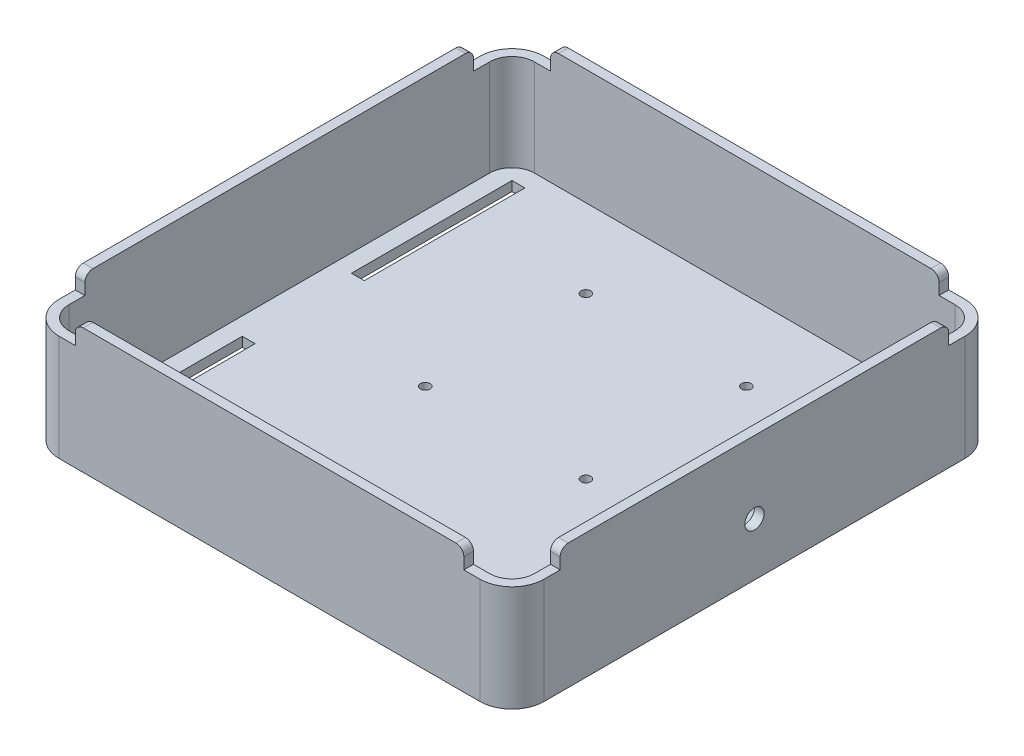
from build123d import *

# Parameters (mm, degrees)
SKETCH1_W           = 151
SKETCH1_H           = 151
BOSS_EXTRUDE1_DEPTH = 16.5
SKETCH2_W           = 145
SKETCH2_H           = 145
CUT_EXTRUDE1_DEPTH  = 30
SKETCH3_W           = 4
SKETCH3_H           = 50
CUT_EXTRUDE2_DEPTH  = 111.907619215
SKETCH6_W           = 121
SKETCH6_H           = 3
BOSS_EXTRUDE2_DEPTH = 6
SKETCH7_W           = 3
SKETCH7_H           = 121
BOSS_EXTRUDE3_DEPTH = 6
CUT_EXTRUDE3_REACH  = 172.316
SKETCH8_R           = 3
FILLET1_R           = 10
FILLET2_R           = 7
FILLET3_R           = 2.5
SKETCH12_R          = 1.5
CUT_EXTRUDE4_DEPTH  = 114.672775984


with BuildPart() as part:
    # Sketch1 → Boss-Extrude1 (new, symmetric)
    with BuildSketch(Plane(origin=(0, 0, 0), x_dir=(1, 0, 0), z_dir=(0, 1, 0))):
        Rectangle(SKETCH1_W, SKETCH1_H)
    extrude(amount=BOSS_EXTRUDE1_DEPTH, both=True)

    # Sketch2 → Cut-Extrude1 (cut)
    with BuildSketch(Plane(origin=(0, 16.5, 0), x_dir=(1, 0, 0), z_dir=(0, 1, 0))):
        Rectangle(SKETCH2_W, SKETCH2_H)
    extrude(amount=-CUT_EXTRUDE1_DEPTH, mode=Mode.SUBTRACT)

    # Sketch3 → Cut-Extrude2 (cut, through all)
    with BuildSketch(Plane(origin=(0, -13.5, 0), x_dir=(1, 0, 0), z_dir=(0, 1, 0))):
        with Locations((-65, -42)):
            Rectangle(SKETCH3_W, SKETCH3_H)
        with Locations((-65, 42)):
            Rectangle(SKETCH3_W, SKETCH3_H)
    cut_extrude2 = extrude(amount=-CUT_EXTRUDE2_DEPTH, mode=Mode.SUBTRACT)

    # Mirror1: Cut-Extrude2 across plane
    add(cut_extrude2.mirror(Plane(origin=(0, 0, 0), x_dir=(0, 0, 1), z_dir=(1, 0, 0))), mode=Mode.SUBTRACT)

    # Sketch6 → Boss-Extrude2 (add)
    with BuildSketch(Plane(origin=(0, 16.5, 0), x_dir=(1, 0, 0), z_dir=(0, 1, 0))):
        with Locations((0, -74)):
            Rectangle(SKETCH6_W, SKETCH6_H)
    boss_extrude2 = extrude(amount=BOSS_EXTRUDE2_DEPTH)

    # Mirror2: Boss-Extrude2 across plane
    add(boss_extrude2.mirror(Plane.XY))

    # Sketch7 → Boss-Extrude3 (add)
    with BuildSketch(Plane(origin=(0, 16.5, 0), x_dir=(1, 0, 0), z_dir=(0, 1, 0))):
        with Locations((-74, 0)):
            Rectangle(SKETCH7_W, SKETCH7_H)
    boss_extrude3 = extrude(amount=BOSS_EXTRUDE3_DEPTH)

    # Mirror4: Boss-Extrude3 across plane
    add(boss_extrude3.mirror(Plane(origin=(0, 0, 0), x_dir=(0, 0, 1), z_dir=(1, 0, 0))))

    # Sketch8 → Cut-Extrude3 (cut, up to next)
    with BuildSketch(Plane(origin=(75.5, 0, 0), x_dir=(0, 0, -1), z_dir=(1, 0, 0)), mode=Mode.PRIVATE) as cut_extrude3_sk1:
        Circle(SKETCH8_R)
    cut_extrude3_tool1 = extrude(cut_extrude3_sk1.sketch, amount=-CUT_EXTRUDE3_REACH, mode=Mode.PRIVATE) & part.part
    add(cut_extrude3_tool1.solids().sort_by_distance((75.5, 0, 0))[0], mode=Mode.SUBTRACT)

    # Fillet1
    fillet1_edges = [part.edges().sort_by_distance(p)[0] for p in [
        (75.5, 0, 75.5),
        (-75.5, 0, 75.5),
        (-75.5, 0, -75.5),
        (75.5, 0, -75.5),
    ]]
    fillet(fillet1_edges, radius=FILLET1_R)

    # Fillet2
    fillet2_edges = [part.edges().sort_by_distance(p)[0] for p in [
        (72.5, 1.5, -72.5),
        (72.5, 1.5, 72.5),
        (-72.5, 1.5, 72.5),
        (-72.5, 1.5, -72.5),
    ]]
    fillet(fillet2_edges, radius=FILLET2_R)

    # Fillet3
    fillet3_edges = [part.edges().sort_by_distance(p)[0] for p in [
        (-60.5, 22.5, -74),
        (60.5, 22.5, -74),
        (-74, 22.5, -60.5),
        (-74, 22.5, 60.5),
        (74, 22.5, 60.5),
        (74, 22.5, -60.5),
        (-60.5, 22.5, 74),
        (60.5, 22.5, 74),
    ]]
    fillet(fillet3_edges, radius=FILLET3_R)

    # Sketch12 → Cut-Extrude4 (cut, through all)
    with BuildSketch(Plane.XZ.offset(16.5)):
        with Locations(Location((-25, 52, 0), (0, 0, 270))):
            Circle(SKETCH12_R)
        with Locations(Location((-25, 2, 0), (0, 0, 270))):
            Circle(SKETCH12_R)
        with Locations(Location((25, 52, 0), (0, 0, 270))):
            Circle(SKETCH12_R)
        with Locations(Location((25, 2, 0), (0, 0, 270))):
            Circle(SKETCH12_R)
        with Locations(Location((-25, -48, 0), (0, 0, 270))):
            Circle(SKETCH12_R)
        with Locations(Location((25, -48, 0), (0, 0, 270))):
            Circle(SKETCH12_R)
    extrude(amount=-CUT_EXTRUDE4_DEPTH, mode=Mode.SUBTRACT)


solid = part.part
